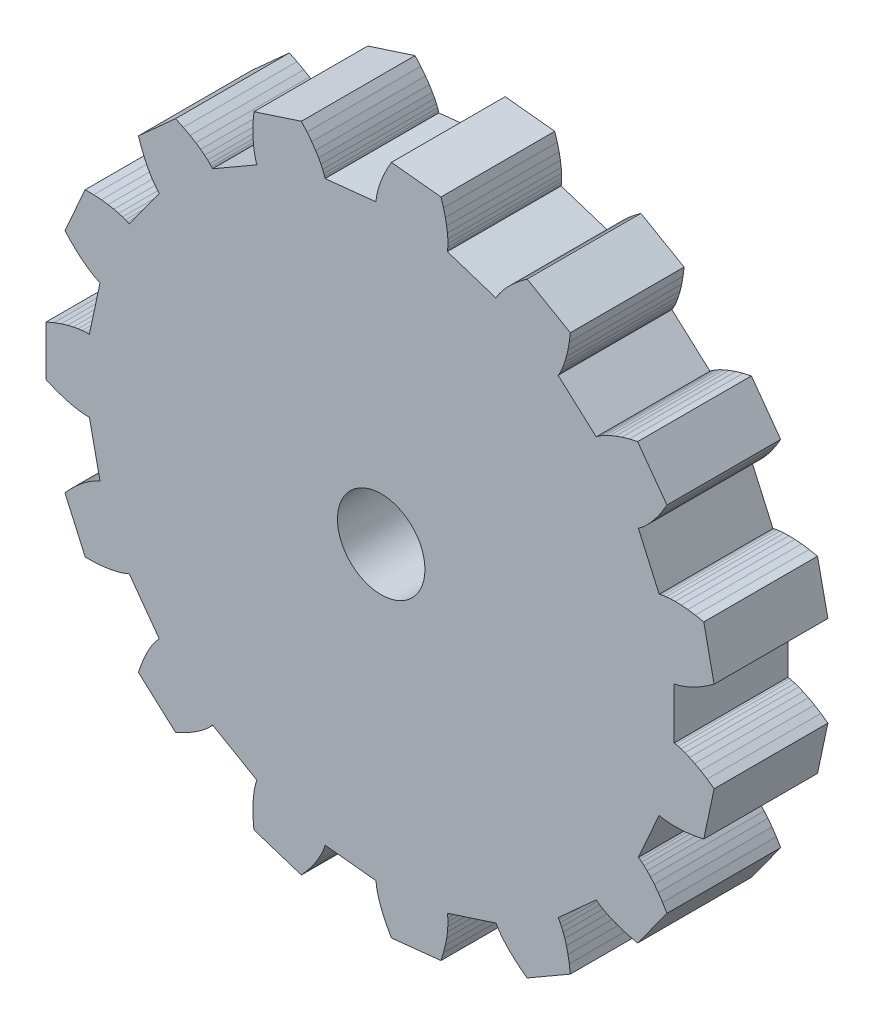
from build123d import *

# Parameters (mm, degrees)
BOSS_EXTRUDE1_DEPTH = 6.5
CUT_EXTRUDE1_REACH  = 29.878
SKETCH2_R           = 2.5


with BuildPart() as part:
    # Model → Boss-Extrude1 (new body)
    with BuildSketch(Plane.XY):
        Polygon((16.736061141, -1.464328342), (16.736061141, 1.464328342), (16.761575313, 1.467512532), (16.837552795, 1.480815947), (16.962797386, 1.509802917), (17.135653618, 1.559927907), (17.354015722, 1.636501858), (17.615338891, 1.744659209), (17.916652818, 1.889325751), (18.254577425, 2.075187466), (18.625340732, 2.30666049), (19.024798777, 2.587862339), (18.432596946, 5.373952905), (17.953298767, 5.468369353), (17.520441072, 5.52902746), (17.136134812, 5.561374265), (16.802029659, 5.570978312), (16.519307507, 5.563495259), (16.288678367, 5.544633176), (16.110378671, 5.52011767), (15.984171981, 5.49565702), (15.909352111, 5.476907467), (15.884748628, 5.469438821), (14.69355664, 8.144899832), (14.715569869, 8.158186283), (14.779567767, 8.201242383), (14.882194331, 8.278664862), (15.019718686, 8.394763283), (15.188056962, 8.553532938), (15.382795999, 8.758629303), (15.599218785, 9.01334418), (15.832331505, 9.320583626), (16.076892079, 9.682847778), (16.327440065, 10.102212675), (14.653231648, 12.406562871), (14.176968345, 12.297868456), (13.756861289, 12.177223308), (13.392623419, 12.050462146), (13.083496857, 11.923343071), (12.828260951, 11.801513504), (12.625242648, 11.690476811), (12.472329125, 11.595559762), (12.36698262, 11.521880961), (12.306257397, 11.47432041), (12.286818769, 11.457490324), (10.110402709, 13.417144147), (10.125108708, 13.438235511), (10.166061203, 13.503599506), (10.228324675, 13.616070444), (10.306737944, 13.778067824), (10.395945175, 13.991580466), (10.49042793, 14.25815282), (10.584538109, 14.578873517), (10.672531634, 14.954366202), (10.748602731, 15.38478272), (10.806918635, 15.869798663), (8.340189478, 17.293965406), (7.949311302, 17.00095438), (7.614595212, 16.719866619), (7.33340577, 16.455915648), (7.102708588, 16.214053494), (6.919091535, 15.99894285), (6.778787779, 15.814930801), (6.677700566, 15.666024229), (6.611429613, 15.555867011), (6.575298981, 15.487719113), (6.564386323, 15.464437662), (3.7790683, 16.369442348), (3.783924267, 16.394691737), (3.794750302, 16.471061597), (3.805884762, 16.599133748), (3.811628577, 16.779019268), (3.806280022, 17.010356622), (3.78416957, 17.292312184), (3.739694636, 17.623583178), (3.667354088, 18.002403006), (3.561782323, 18.426548963), (3.417782796, 18.89335229), (0.585052778, 19.191084212), (0.347146118, 18.764420843), (0.155696446, 18.371493097), (0.006175641, 18.015991837), (-0.106202521, 17.701206768), (-0.186451665, 17.430009632), (-0.239781081, 17.204839582), (-0.271563085, 17.027690786), (-0.287299637, 16.900102335), (-0.292588364, 16.823150479), (-0.293088154, 16.797443238), (-3.20570135, 16.491315255), (-3.211535055, 16.51635682), (-3.232707401, 16.590527504), (-3.274627202, 16.712056028), (-3.342545999, 16.878725848), (-3.441525525, 17.087887583), (-3.576406088, 17.336473675), (-3.751776013, 17.621015202), (-3.971942298, 17.937660784), (-4.240902607, 18.282197491), (-4.562318739, 18.650073665), (-7.271244862, 17.769890213), (-7.315043784, 17.283348473), (-7.33012365, 16.846521519), (-7.322122313, 16.460939367), (-7.29675025, 16.12766058), (-7.259755678, 15.847269402), (-7.216889614, 15.619875297), (-7.173871013, 15.445114914), (-7.136352169, 15.322156432), (-7.109884523, 15.249706295), (-7.099885027, 15.226018278), (-9.636176114, 13.761689936), (-9.65169079, 13.782193762), (-9.701200626, 13.841340485), (-9.788926373, 13.935311997), (-9.918764005, 14.05994739), (-10.094260044, 14.210767543), (-10.318588641, 14.383001371), (-10.594530505, 14.571613616), (-10.924453776, 14.771334053), (-11.310296948, 14.976687983), (-11.753553916, 15.182027873), (-13.870278208, 13.27612076), (-13.71239616, 12.813828138), (-13.548498774, 12.408633324), (-13.384358799, 12.059640937), (-13.225623571, 11.765495364), (-13.077781982, 11.524392324), (-12.946132369, 11.334092672), (-12.835751469, 11.191938359), (-12.75146458, 11.094870484), (-12.697817056, 11.039449352), (-12.679047278, 11.021876434), (-14.400468486, 8.652543406), (-14.422981505, 8.664964196), (-14.49226813, 8.698859951), (-14.610631246, 8.749025923), (-14.779937605, 8.810076298), (-15.001605297, 8.876476694), (-15.276593478, 8.942577465), (-15.605394425, 9.002647657), (-15.98802795, 9.050909471), (-16.424038196, 9.081573065), (-16.912492843, 9.088871538), (-18.071014444, 6.486789419), (-17.738750667, 6.128680507), (-17.424215376, 5.825179699), (-17.132318056, 5.573121031), (-16.867666426, 5.368969113), (-16.634540973, 5.208843118), (-16.436871225, 5.088542457), (-16.278213888, 5.003573986), (-16.161732922, 4.949180636), (-16.090181665, 4.920371327), (-16.065887069, 4.911952024), (-16.674789032, 2.047293515), (-16.700407689, 2.049483601), (-16.777490816, 2.052267506), (-16.906025242, 2.049953785), (-17.085525722, 2.036862977), (-17.31503671, 2.007362385), (-17.593136518, 1.955900674), (-17.917943879, 1.877042131), (-18.287126846, 1.765500417), (-18.697914033, 1.61617166), (-19.147108113, 1.424166743), (-19.147108113, -1.424166743), (-18.697914033, -1.61617166), (-18.287126846, -1.765500417), (-17.917943879, -1.877042131), (-17.593136518, -1.955900674), (-17.31503671, -2.007362385), (-17.085525722, -2.036862977), (-16.906025242, -2.049953785), (-16.777490816, -2.052267506), (-16.700407689, -2.049483601), (-16.674789032, -2.047293515), (-16.065887069, -4.911952024), (-16.090181665, -4.920371327), (-16.161732922, -4.949180636), (-16.278213888, -5.003573986), (-16.436871225, -5.088542457), (-16.634540973, -5.208843118), (-16.867666426, -5.368969113), (-17.132318056, -5.573121031), (-17.424215376, -5.825179699), (-17.738750667, -6.128680507), (-18.071014444, -6.486789419), (-16.912492843, -9.088871538), (-16.424038196, -9.081573065), (-15.98802795, -9.050909471), (-15.605394425, -9.002647657), (-15.276593478, -8.942577465), (-15.001605297, -8.876476694), (-14.779937605, -8.810076298), (-14.610631246, -8.749025923), (-14.49226813, -8.698859951), (-14.422981505, -8.664964196), (-14.400468486, -8.652543406), (-12.679047278, -11.021876434), (-12.697817056, -11.039449352), (-12.75146458, -11.094870484), (-12.835751469, -11.191938359), (-12.946132369, -11.334092672), (-13.077781982, -11.524392324), (-13.225623571, -11.765495364), (-13.384358799, -12.059640937), (-13.548498774, -12.408633324), (-13.71239616, -12.813828138), (-13.870278208, -13.27612076), (-11.753553916, -15.182027873), (-11.310296948, -14.976687983), (-10.924453776, -14.771334053), (-10.594530505, -14.571613616), (-10.318588641, -14.383001371), (-10.094260044, -14.210767543), (-9.918764005, -14.05994739), (-9.788926373, -13.935311997), (-9.701200626, -13.841340485), (-9.65169079, -13.782193762), (-9.636176114, -13.761689936), (-7.099885027, -15.226018278), (-7.109884523, -15.249706295), (-7.136352169, -15.322156432), (-7.173871013, -15.445114914), (-7.216889614, -15.619875297), (-7.259755678, -15.847269402), (-7.29675025, -16.12766058), (-7.322122313, -16.460939367), (-7.33012365, -16.846521519), (-7.315043784, -17.283348473), (-7.271244862, -17.769890213), (-4.562318739, -18.650073665), (-4.240902607, -18.282197491), (-3.971942298, -17.937660784), (-3.751776013, -17.621015202), (-3.576406088, -17.336473675), (-3.441525525, -17.087887583), (-3.342545999, -16.878725848), (-3.274627202, -16.712056028), (-3.232707401, -16.590527504), (-3.211535055, -16.51635682), (-3.20570135, -16.491315255), (-0.293088154, -16.797443238), (-0.292588364, -16.823150479), (-0.287299637, -16.900102335), (-0.271563085, -17.027690786), (-0.239781081, -17.204839582), (-0.186451665, -17.430009632), (-0.106202521, -17.701206768), (0.006175641, -18.015991837), (0.155696446, -18.371493097), (0.347146118, -18.764420843), (0.585052778, -19.191084212), (3.417782796, -18.89335229), (3.561782323, -18.426548963), (3.667354088, -18.002403006), (3.739694636, -17.623583178), (3.78416957, -17.292312184), (3.806280022, -17.010356622), (3.811628577, -16.779019268), (3.805884762, -16.599133748), (3.794750302, -16.471061597), (3.783924267, -16.394691737), (3.7790683, -16.369442348), (6.564386323, -15.464437662), (6.575298981, -15.487719113), (6.611429613, -15.555867011), (6.677700566, -15.666024229), (6.778787779, -15.814930801), (6.919091535, -15.99894285), (7.102708588, -16.214053494), (7.33340577, -16.455915648), (7.614595212, -16.719866619), (7.949311302, -17.00095438), (8.340189478, -17.293965406), (10.806918635, -15.869798663), (10.748602731, -15.38478272), (10.672531634, -14.954366202), (10.584538109, -14.578873517), (10.49042793, -14.25815282), (10.395945175, -13.991580466), (10.306737944, -13.778067824), (10.228324675, -13.616070444), (10.166061203, -13.503599506), (10.125108708, -13.438235511), (10.110402709, -13.417144147), (12.286818769, -11.457490324), (12.306257397, -11.47432041), (12.36698262, -11.521880961), (12.472329125, -11.595559762), (12.625242648, -11.690476811), (12.828260951, -11.801513504), (13.083496857, -11.923343071), (13.392623419, -12.050462146), (13.756861289, -12.177223308), (14.176968345, -12.297868456), (14.653231648, -12.406562871), (16.327440065, -10.102212675), (16.076892079, -9.682847778), (15.832331505, -9.320583626), (15.599218785, -9.01334418), (15.382795999, -8.758629303), (15.188056962, -8.553532938), (15.019718686, -8.394763283), (14.882194331, -8.278664862), (14.779567767, -8.201242383), (14.715569869, -8.158186283), (14.69355664, -8.144899832), (15.884748628, -5.469438821), (15.909352111, -5.476907467), (15.984171981, -5.49565702), (16.110378671, -5.52011767), (16.288678367, -5.544633176), (16.519307507, -5.563495259), (16.802029659, -5.570978312), (17.136134812, -5.561374265), (17.520441072, -5.52902746), (17.953298767, -5.468369353), (18.432596946, -5.373952905), (19.024798777, -2.587862339), (18.625340732, -2.30666049), (18.254577425, -2.075187466), (17.916652818, -1.889325751), (17.615338891, -1.744659209), (17.354015722, -1.636501858), (17.135653618, -1.559927907), (16.962797386, -1.509802917), (16.837552795, -1.480815947), (16.761575313, -1.467512532), align=None)
    extrude(amount=BOSS_EXTRUDE1_DEPTH)

    # Sketch2 → Cut-Extrude1 (cut, up to next)
    with BuildSketch(Plane.XY.offset(6.5), mode=Mode.PRIVATE) as cut_extrude1_sk1:
        Circle(SKETCH2_R)
    cut_extrude1_tool1 = extrude(cut_extrude1_sk1.sketch, amount=-CUT_EXTRUDE1_REACH, mode=Mode.PRIVATE) & part.part
    add(cut_extrude1_tool1.solids().sort_by_distance((0, 0, 6.5))[0], mode=Mode.SUBTRACT)


solid = part.part
